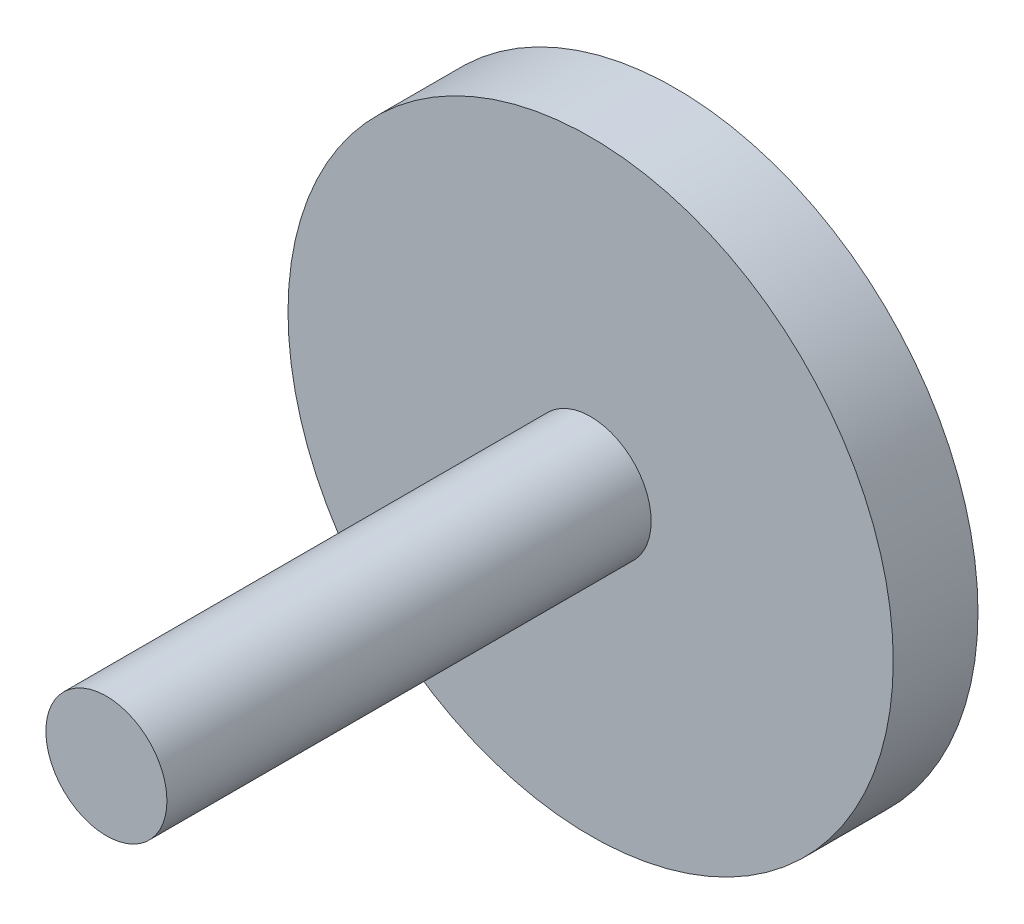
from build123d import *

# Parameters (mm, degrees)
SKETCH1_R           = 25
BOSS_EXTRUDE1_DEPTH = 7
SKETCH2_R           = 5
BOSS_EXTRUDE2_DEPTH = 40


with BuildPart() as part:
    # Sketch1 → Boss-Extrude1 (new body)
    with BuildSketch(Plane.XY):
        Circle(SKETCH1_R)
    extrude(amount=BOSS_EXTRUDE1_DEPTH)

    # Sketch2 → Boss-Extrude2 (add)
    with BuildSketch(Plane.XY.offset(7)):
        Circle(SKETCH2_R)
    extrude(amount=BOSS_EXTRUDE2_DEPTH)


solid = part.part
